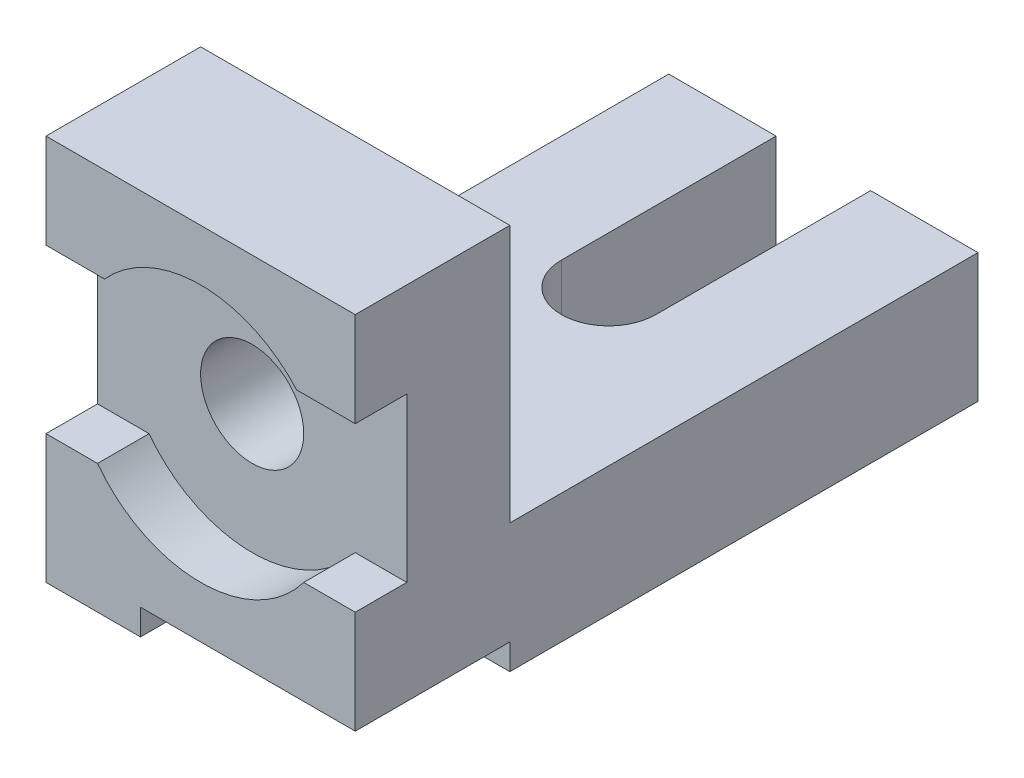
from build123d import *

# Parameters (mm, degrees)
SKETCH1_R           = 12
BOSS_EXTRUDE1_DEPTH = 24
BOSS_EXTRUDE2_DEPTH = 36
SKETCH1_9_W         = 72
SKETCH1_9_H         = 30
BOSS_EXTRUDE5_DEPTH = 109
SKETCH1_10_W        = 50
SKETCH1_10_H        = 6
BOSS_EXTRUDE6_DEPTH = 36
CUT_EXTRUDE1_DEPTH  = 30


with BuildPart() as part:
    # Sketch1 → Boss-Extrude1 (new body)
    # profile 1 of 5: a face of its own
    with BuildSketch(Plane.XY):
        with BuildLine():
            Line((22.360679775, 23), (-22.360679775, 23))
            ThreePointArc((-22.360679775, 23), (-29.972123003, 4.292997564), (-24, -15))
            Line((-24, -15), (24, -15))
            ThreePointArc((24, -15), (28.460498942, -6.486832981), (30, 3))
            ThreePointArc((30, 3), (28.025170769, 13.704662693), (22.360679775, 23))
        make_face()
        with Locations((0, 3)):
            Circle(SKETCH1_R, mode=Mode.SUBTRACT)
    # profile 2 of 5: a face of its own
    with BuildSketch(Plane.XY):
        with BuildLine():
            ThreePointArc((22.360679775, 23), (0, 33), (-22.360679775, 23))
            Line((-22.360679775, 23), (22.360679775, 23))
        make_face()
    # profile 3 of 5: a face of its own
    with BuildSketch(Plane.XY):
        with BuildLine():
            Line((24, -15), (-24, -15))
            ThreePointArc((-24, -15), (0, -27), (24, -15))
        make_face()
    # profile 4 of 5: a face of its own
    with BuildSketch(Plane.XY):
        with BuildLine():
            Line((36, -15), (36, 23))
            Line((36, 23), (22.360679775, 23))
            ThreePointArc((22.360679775, 23), (28.025170769, 13.704662693), (30, 3))
            ThreePointArc((30, 3), (28.460498942, -6.486832981), (24, -15))
            Line((24, -15), (36, -15))
        make_face()
    # profile 5 of 5: a face of its own
    with BuildSketch(Plane.XY):
        with BuildLine():
            Line((-22.360679775, 23), (-36, 23))
            Line((-36, 23), (-36, -15))
            Line((-36, -15), (-24, -15))
            ThreePointArc((-24, -15), (-29.972123003, 4.292997564), (-22.360679775, 23))
        make_face()
    extrude(amount=BOSS_EXTRUDE1_DEPTH)

    # Sketch1<4> → Boss-Extrude2 (add)
    with BuildSketch(Plane.XY):
        with BuildLine():
            Line((36, 45), (-36, 45))
            Line((-36, 45), (-36, 23))
            Line((-36, 23), (-22.360679775, 23))
            ThreePointArc((-22.360679775, 23), (0, 33), (22.360679775, 23))
            Line((22.360679775, 23), (36, 23))
            Line((36, 23), (36, 45))
        make_face()
        with BuildLine():
            Line((-24, -15), (-36, -15))
            Line((-36, -15), (-36, -45))
            Line((-36, -45), (-14, -45))
            Line((-14, -45), (-14, -39))
            Line((-14, -39), (36, -39))
            Line((36, -39), (36, -15))
            Line((36, -15), (24, -15))
            ThreePointArc((24, -15), (0, -27), (-24, -15))
        make_face()
    extrude(amount=BOSS_EXTRUDE2_DEPTH)

    # Sketch1<9> → Boss-Extrude5 (add)
    with BuildSketch(Plane.XY):
        with Locations((0, -30)):
            Rectangle(SKETCH1_9_W, SKETCH1_9_H)
    extrude(amount=-BOSS_EXTRUDE5_DEPTH)

    # Sketch1<10> → Boss-Extrude6 (add)
    with BuildSketch(Plane.XY):
        with Locations((11, -42)):
            Rectangle(SKETCH1_10_W, SKETCH1_10_H)
    extrude(amount=-BOSS_EXTRUDE6_DEPTH)

    # Sketch3 → Cut-Extrude1 (cut)
    with BuildSketch(Plane(origin=(0, -15, 0), x_dir=(1, 0, 0), z_dir=(0, 1, 0))):
        with BuildLine():
            Line((11, 59), (11, 109))
            Line((11, 109), (-11, 109))
            Line((-11, 109), (-11, 59))
            ThreePointArc((-11, 59), (0, 70), (11, 59))
        make_face()
        with BuildLine():
            ThreePointArc((-11, 59), (0, 48), (11, 59))
            Line((11, 59), (-11, 59))
        make_face()
        with BuildLine():
            Line((-11, 59), (11, 59))
            ThreePointArc((11, 59), (0, 70), (-11, 59))
        make_face()
    extrude(amount=-CUT_EXTRUDE1_DEPTH, mode=Mode.SUBTRACT)


solid = part.part
